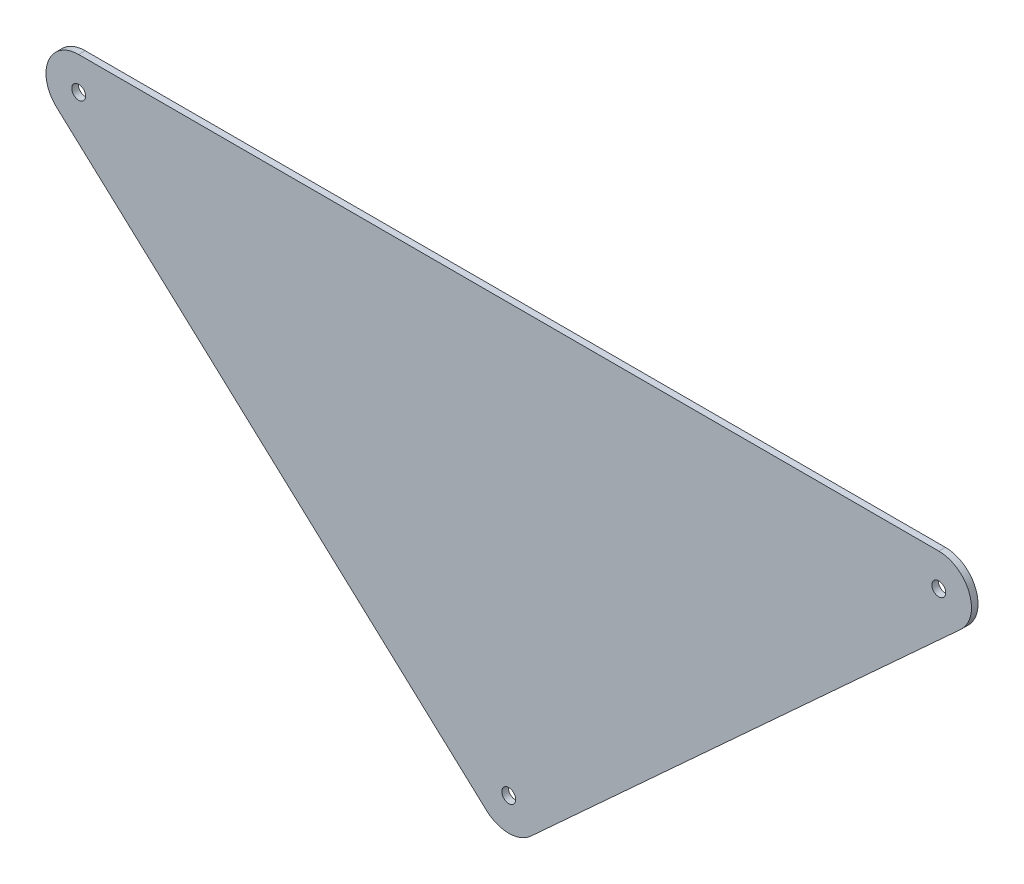
from build123d import *

# Parameters (mm, degrees)
SKETCH_1_R      = 0.85
EXTRUDE_1_DEPTH = 0.8


with BuildPart() as part:
    # 草图1 → 凸台-拉伸1 (new body)
    with BuildSketch(Plane.XY):
        with BuildLine():
            Line((52.621031394, 26), (-52.621031394, 26))
            ThreePointArc((-52.621031394, 26), (-56.349062871, 23.449752153), (-55.323392225, 19.050890653))
            Line((-55.323392225, 19.050890653), (-2.70236083, -29.167400823))
            ThreePointArc((-2.70236083, -29.167400823), (0, -30.218291475), (2.70236083, -29.167400823))
            Line((2.70236083, -29.167400823), (55.323392225, 19.050890653))
            ThreePointArc((55.323392225, 19.050890653), (56.349062871, 23.449752153), (52.621031394, 26))
        make_face()
        with Locations((-52.621031394, 22)):
            Circle(SKETCH_1_R, mode=Mode.SUBTRACT)
        with Locations((52.621031394, 22)):
            Circle(SKETCH_1_R, mode=Mode.SUBTRACT)
        with Locations((0, -26.218291475)):
            Circle(SKETCH_1_R, mode=Mode.SUBTRACT)
    extrude(amount=EXTRUDE_1_DEPTH)


solid = part.part
